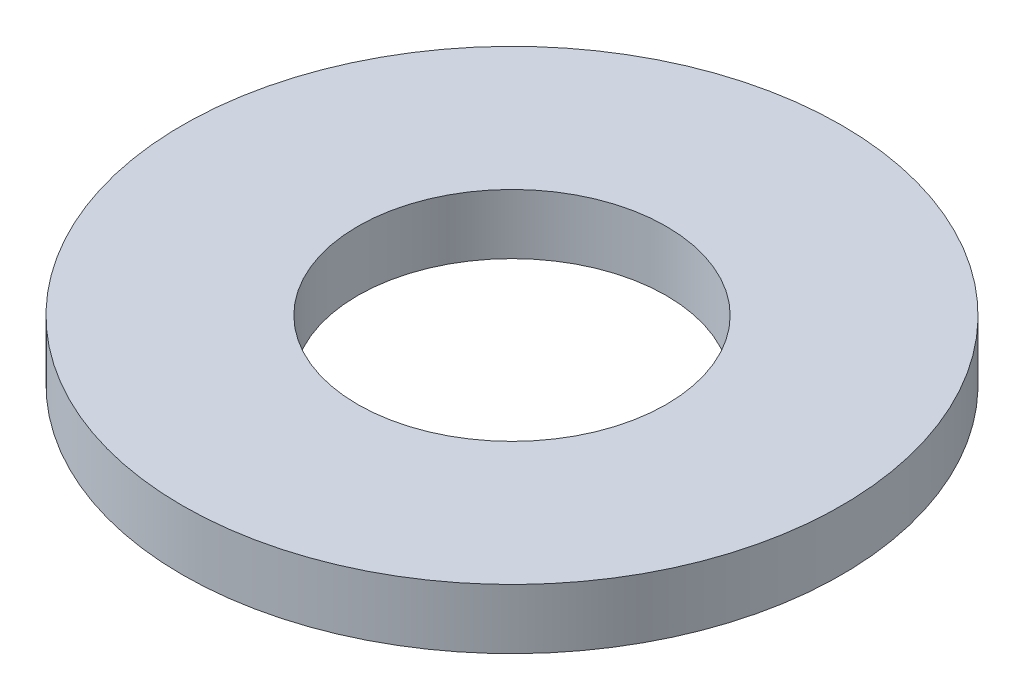
from build123d import *

# Parameters (mm, degrees)
SKETCH1_R           = 11
SKETCH1_R_2         = 5.15
BOSS_EXTRUDE1_DEPTH = 2


with BuildPart() as part:
    # Sketch1 → Boss-Extrude1 (new body)
    with BuildSketch(Plane(origin=(0, 0, 0), x_dir=(1, 0, 0), z_dir=(0, 1, 0))):
        with Locations(Location((0, 0, 0), (0, 0, 270))):
            Circle(SKETCH1_R)
        with Locations(Location((0, 0, 0), (0, 0, 270))):
            Circle(SKETCH1_R_2, mode=Mode.SUBTRACT)
    extrude(amount=BOSS_EXTRUDE1_DEPTH)


solid = part.part
